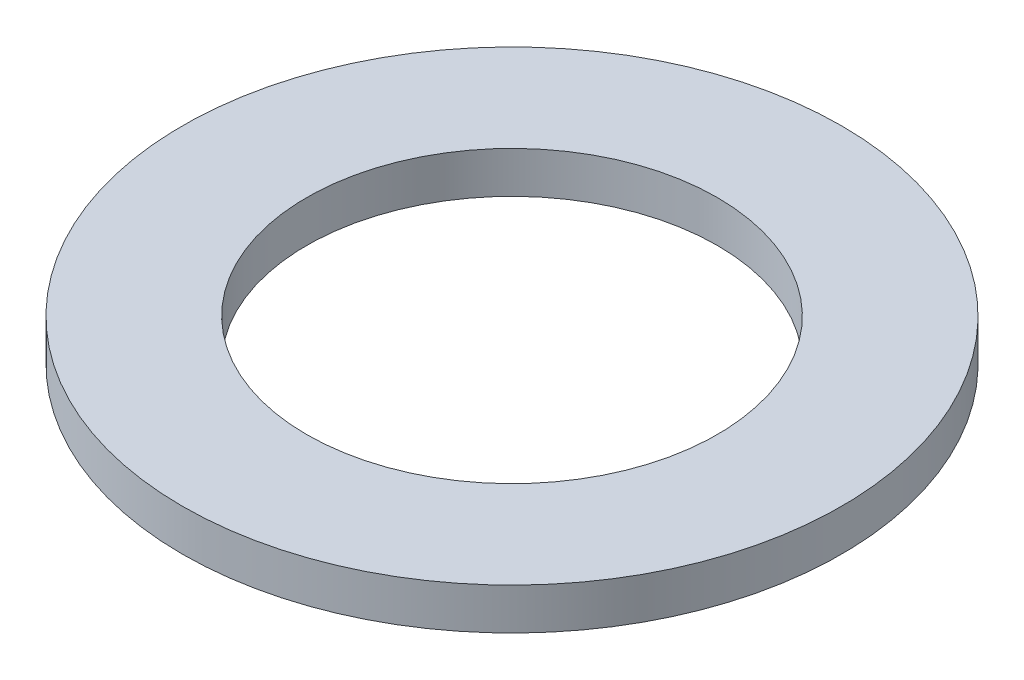
from build123d import *

# Parameters (mm, degrees)
SKETCH1_R           = 12.7
SKETCH1_R_2         = 7.9121
BOSS_EXTRUDE1_DEPTH = 1.6


with BuildPart() as part:
    # Sketch1 → Boss-Extrude1 (new body)
    with BuildSketch(Plane(origin=(0, 0, 0), x_dir=(1, 0, 0), z_dir=(0, 1, 0))):
        with Locations(Location((0, 0, 0), (0, 0, 270))):
            Circle(SKETCH1_R)
        with Locations(Location((0, 0, 0), (0, 0, 270))):
            Circle(SKETCH1_R_2, mode=Mode.SUBTRACT)
    extrude(amount=BOSS_EXTRUDE1_DEPTH)


solid = part.part
